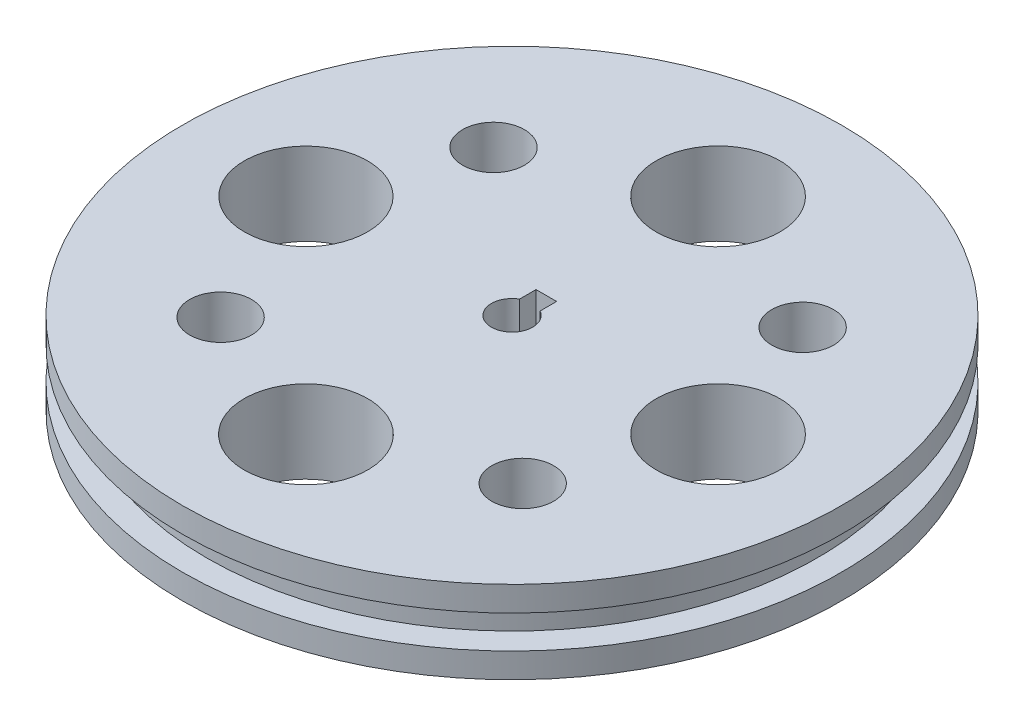
from build123d import *

# Parameters (mm, degrees)
SKETCH3_R          = 19.05
SKETCH3_R_2        = 9.525
SKETCH3_R_3        = 18.988330579
CUT_EXTRUDE2_DEPTH = 146.863175777


with BuildPart() as part:
    # Sketch1 → Revolve1 (revolve)
    with BuildSketch(Plane.XY, mode=Mode.PRIVATE) as revolve1_sk:
        Polygon((0, 0), (101.558930414, 0), (101.558930414, 7.658156006), (94.018592193, 7.658156006), (94.018592193, 17.79048549), (101.558930414, 17.79048549), (101.558930414, 25.448641496), (0, 25.448641496), align=None)
    revolve(revolve1_sk.sketch.rotate(Axis((0, 25.448641496, 0), (0, -1, 0)), 90), axis=Axis((0, 25.448641496, 0), (0, -1, 0)))

    # Sketch3 → Cut-Extrude2 (cut, through all)
    with BuildSketch(Plane(origin=(0, 25.448641496, 0), x_dir=(1, 0, 0), z_dir=(0, 1, 0))):
        with BuildLine():
            Line((3.175, 10.580896572), (-3.175, 10.580896572))
            Line((-3.175, 10.580896572), (-3.175, 5.499261314))
            ThreePointArc((-3.175, 5.499261314), (0, -6.35), (3.175, 5.499261314))
            Line((3.175, 5.499261314), (3.175, 10.580896572))
        make_face()
        with Locations(Location((63.5, 0, 0), (0, 0, 270))):
            Circle(SKETCH3_R)
        with Locations(Location((47.997207269, 41.575450622, 0), (0, 0, 270))):
            Circle(SKETCH3_R_2)
        with Locations(Location((46.521487533, -43.220379426, 0), (0, 0, 270))):
            Circle(SKETCH3_R_2)
        with Locations(Location((0, 63.5, 0), (0, 0, 270))):
            Circle(SKETCH3_R)
        with Locations(Location((0, -63.5, 0), (0, 0, 270))):
            Circle(SKETCH3_R)
        with Locations(Location((-47.659859298, 41.961742239, 0), (0, 0, 270))):
            Circle(SKETCH3_R_2)
        with Locations(Location((-44.386705472, -45.410025075, 0), (0, 0, 270))):
            Circle(SKETCH3_R_2)
        with Locations(Location((-63.5, 0, 0), (0, 0, 270))):
            Circle(SKETCH3_R_3)
    extrude(amount=-CUT_EXTRUDE2_DEPTH, mode=Mode.SUBTRACT)


solid = part.part
